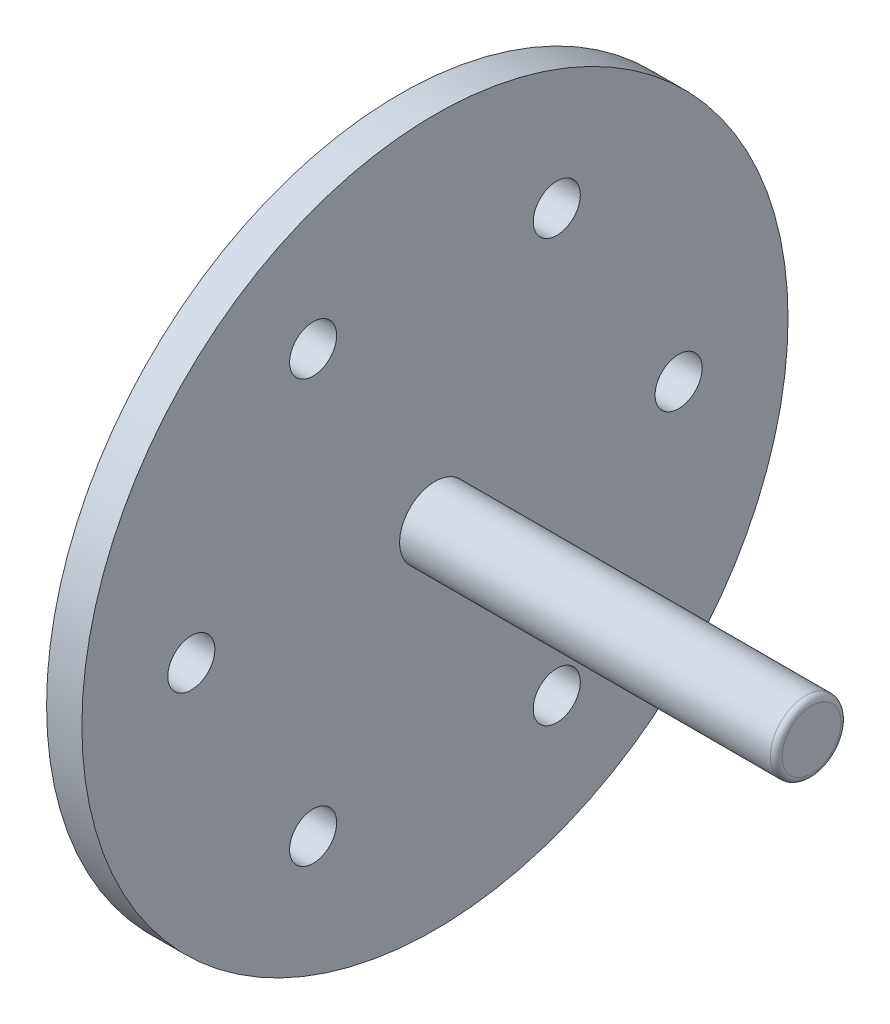
from build123d import *

# Parameters (mm, degrees)
SKETCH1_R           = 30
BOSS_EXTRUDE1_DEPTH = 3
SKETCH2_R           = 2
CUT_EXTRUDE1_DEPTH  = 3
SKETCH3_R           = 3
BOSS_EXTRUDE2_DEPTH = 32
FILLET1_R           = 0.5


with BuildPart() as part:
    # Sketch1 → Boss-Extrude1 (new body)
    with BuildSketch(Plane(origin=(0, 0, 0), x_dir=(0, 0, -1), z_dir=(1, 0, 0))):
        Circle(SKETCH1_R)
    extrude(amount=BOSS_EXTRUDE1_DEPTH)

    # Sketch2 → Cut-Extrude1 (cut)
    with BuildSketch(Plane(origin=(0, 0, 0), x_dir=(0, 0, -1), z_dir=(1, 0, 0))):
        with Locations((20.7, 0)):
            Circle(SKETCH2_R)
        with Locations((10.35, -17.926725858)):
            Circle(SKETCH2_R)
        with Locations((-10.35, -17.926725858)):
            Circle(SKETCH2_R)
        with Locations((-20.7, 0)):
            Circle(SKETCH2_R)
        with Locations((-10.35, 17.926725858)):
            Circle(SKETCH2_R)
        with Locations((10.35, 17.926725858)):
            Circle(SKETCH2_R)
    extrude(amount=CUT_EXTRUDE1_DEPTH, mode=Mode.SUBTRACT)

    # Sketch3 → Boss-Extrude2 (add)
    with BuildSketch(Plane(origin=(3, 0, 0), x_dir=(0, 0, -1), z_dir=(1, 0, 0))):
        Circle(SKETCH3_R)
    extrude(amount=BOSS_EXTRUDE2_DEPTH)

    # Fillet1
    fillet1_edges = [part.edges().sort_by_distance(p)[0] for p in [
        (35, 0, 3),
    ]]
    fillet(fillet1_edges, radius=FILLET1_R)


solid = part.part
